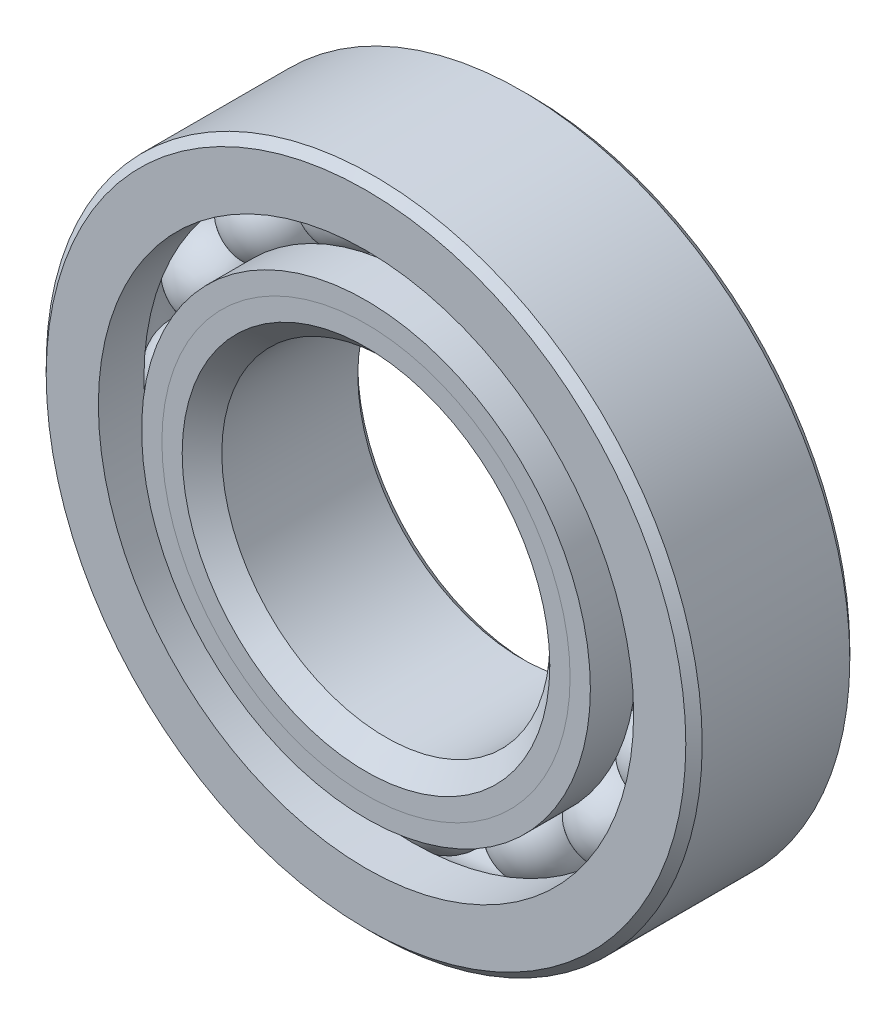
from build123d import *

# Parameters (mm, degrees)
CIRPATTERN1_COUNT = 16


with BuildPart() as part:
    # Sketch1 → Revolve1 (revolve)
    with BuildSketch(Plane(origin=(0, 0, 0), x_dir=(0, 0, -1), z_dir=(1, 0, 0)), mode=Mode.PRIVATE) as revolve1_sk:
        with BuildLine():
            Line((1.42875, 6.35), (-1.42875, 6.35))
            Line((-1.42875, 6.35), (-1.5875, 6.19125))
            Line((-1.5875, 6.19125), (-1.5875, 5.181181319))
            Line((-1.5875, 5.181181319), (-0.705555556, 5.181181319))
            ThreePointArc((-0.705555556, 5.181181319), (0, 5.582928357), (0.705555556, 5.181181319))
            Line((0.705555556, 5.181181319), (1.5875, 5.181181319))
            Line((1.5875, 5.181181319), (1.5875, 6.19125))
            Line((1.5875, 6.19125), (1.42875, 6.35))
        make_face()
    revolve(revolve1_sk.sketch.rotate(Axis((0, 0, 1.5875), (0, 0, -1)), 90), axis=Axis((0, 0, 1.5875), (0, 0, -1)))


with BuildPart() as body_2:
    # Sketch2 → Revolve2 (revolve)
    with BuildSketch(Plane(origin=(0, 0, 0), x_dir=(0, 0, -1), z_dir=(1, 0, 0)), mode=Mode.PRIVATE) as revolve2_sk:
        with BuildLine():
            Line((-1.5875, 4.343818681), (-0.705555556, 4.343818681))
            ThreePointArc((-0.705555556, 4.343818681), (-0.405958534, 4.049548138), (0, 3.942071643))
            Line((0, 3.942071643), (0, 3.558535822))
            Line((0, 3.558535822), (-1.19485857, 3.558535822))
            Line((-1.19485857, 3.558535822), (-1.5875, 3.951177251))
            Line((-1.5875, 3.951177251), (-1.5875, 4.343818681))
        make_face()
    revolve(revolve2_sk.sketch.rotate(Axis((0, 0, 1.5875), (0, 0, -1)), 90), axis=Axis((0, 0, 1.5875), (0, 0, -1)))


with BuildPart() as body_3:
    # Sketch3 → Revolve3 (revolve)
    with BuildSketch(Plane(origin=(0, 0, 0), x_dir=(0, 0, -1), z_dir=(1, 0, 0)), mode=Mode.PRIVATE) as revolve3_sk:
        with BuildLine():
            Line((-1.5875, 3.951177251), (-1.19485857, 3.558535822))
            Line((-1.19485857, 3.558535822), (0, 3.558535822))
            Line((0, 3.558535822), (0, 3.942071643))
            ThreePointArc((0, 3.942071643), (0.405958534, 4.049548138), (0.705555556, 4.343818681))
            Line((0.705555556, 4.343818681), (1.5875, 4.343818681))
            Line((1.5875, 4.343818681), (1.5875, 3.33375))
            Line((1.5875, 3.33375), (1.42875, 3.175))
            Line((1.42875, 3.175), (-1.203964178, 3.175))
            Line((-1.203964178, 3.175), (-1.5875, 3.558535822))
            Line((-1.5875, 3.558535822), (-1.5875, 3.951177251))
        make_face()
    revolve(revolve3_sk.sketch.rotate(Axis((0, 0, 1.5875), (0, 0, -1)), 90), axis=Axis((0, 0, 1.5875), (0, 0, -1)))


with BuildPart() as body_4:
    # Sketch4 → Revolve4 (revolve)
    with BuildSketch(Plane(origin=(0, 0, 0), x_dir=(0, 0, -1), z_dir=(1, 0, 0))):
        with BuildLine():
            Line((-0.820428357, 4.7625), (0.820428357, 4.7625))
            ThreePointArc((0.820428357, 4.7625), (0, 5.582928357), (-0.820428357, 4.7625))
        make_face()
    revolve(axis=Axis((0, 4.7625, 0.820428357), (0, 0, -1)))


with BuildPart() as cirpattern1_1:
    # CirPattern1: pattern copy
    add(body_4.part.rotate(Axis((0, 0, 0), (0, 0, 1)), 1 * 360 / CIRPATTERN1_COUNT))


with BuildPart() as cirpattern1_2:
    # CirPattern1: pattern copy
    add(body_4.part.rotate(Axis((0, 0, 0), (0, 0, 1)), 2 * 360 / CIRPATTERN1_COUNT))


with BuildPart() as cirpattern1_3:
    # CirPattern1: pattern copy
    add(body_4.part.rotate(Axis((0, 0, 0), (0, 0, 1)), 3 * 360 / CIRPATTERN1_COUNT))


with BuildPart() as cirpattern1_4:
    # CirPattern1: pattern copy
    add(body_4.part.rotate(Axis((0, 0, 0), (0, 0, 1)), 4 * 360 / CIRPATTERN1_COUNT))


with BuildPart() as cirpattern1_5:
    # CirPattern1: pattern copy
    add(body_4.part.rotate(Axis((0, 0, 0), (0, 0, 1)), 5 * 360 / CIRPATTERN1_COUNT))


with BuildPart() as cirpattern1_6:
    # CirPattern1: pattern copy
    add(body_4.part.rotate(Axis((0, 0, 0), (0, 0, 1)), 6 * 360 / CIRPATTERN1_COUNT))


with BuildPart() as cirpattern1_7:
    # CirPattern1: pattern copy
    add(body_4.part.rotate(Axis((0, 0, 0), (0, 0, 1)), 7 * 360 / CIRPATTERN1_COUNT))


with BuildPart() as cirpattern1_8:
    # CirPattern1: pattern copy
    add(body_4.part.rotate(Axis((0, 0, 0), (0, 0, 1)), 8 * 360 / CIRPATTERN1_COUNT))


with BuildPart() as cirpattern1_9:
    # CirPattern1: pattern copy
    add(body_4.part.rotate(Axis((0, 0, 0), (0, 0, 1)), 9 * 360 / CIRPATTERN1_COUNT))


with BuildPart() as cirpattern1_10:
    # CirPattern1: pattern copy
    add(body_4.part.rotate(Axis((0, 0, 0), (0, 0, 1)), 10 * 360 / CIRPATTERN1_COUNT))


with BuildPart() as cirpattern1_11:
    # CirPattern1: pattern copy
    add(body_4.part.rotate(Axis((0, 0, 0), (0, 0, 1)), 11 * 360 / CIRPATTERN1_COUNT))


with BuildPart() as cirpattern1_12:
    # CirPattern1: pattern copy
    add(body_4.part.rotate(Axis((0, 0, 0), (0, 0, 1)), 12 * 360 / CIRPATTERN1_COUNT))


with BuildPart() as cirpattern1_13:
    # CirPattern1: pattern copy
    add(body_4.part.rotate(Axis((0, 0, 0), (0, 0, 1)), 13 * 360 / CIRPATTERN1_COUNT))


with BuildPart() as cirpattern1_14:
    # CirPattern1: pattern copy
    add(body_4.part.rotate(Axis((0, 0, 0), (0, 0, 1)), 14 * 360 / CIRPATTERN1_COUNT))


with BuildPart() as cirpattern1_15:
    # CirPattern1: pattern copy
    add(body_4.part.rotate(Axis((0, 0, 0), (0, 0, 1)), 15 * 360 / CIRPATTERN1_COUNT))


solid = Compound([part.part, body_2.part, body_3.part, body_4.part, cirpattern1_1.part, cirpattern1_2.part, cirpattern1_3.part, cirpattern1_4.part, cirpattern1_5.part, cirpattern1_6.part, cirpattern1_7.part, cirpattern1_8.part, cirpattern1_9.part, cirpattern1_10.part, cirpattern1_11.part, cirpattern1_12.part, cirpattern1_13.part, cirpattern1_14.part, cirpattern1_15.part])
